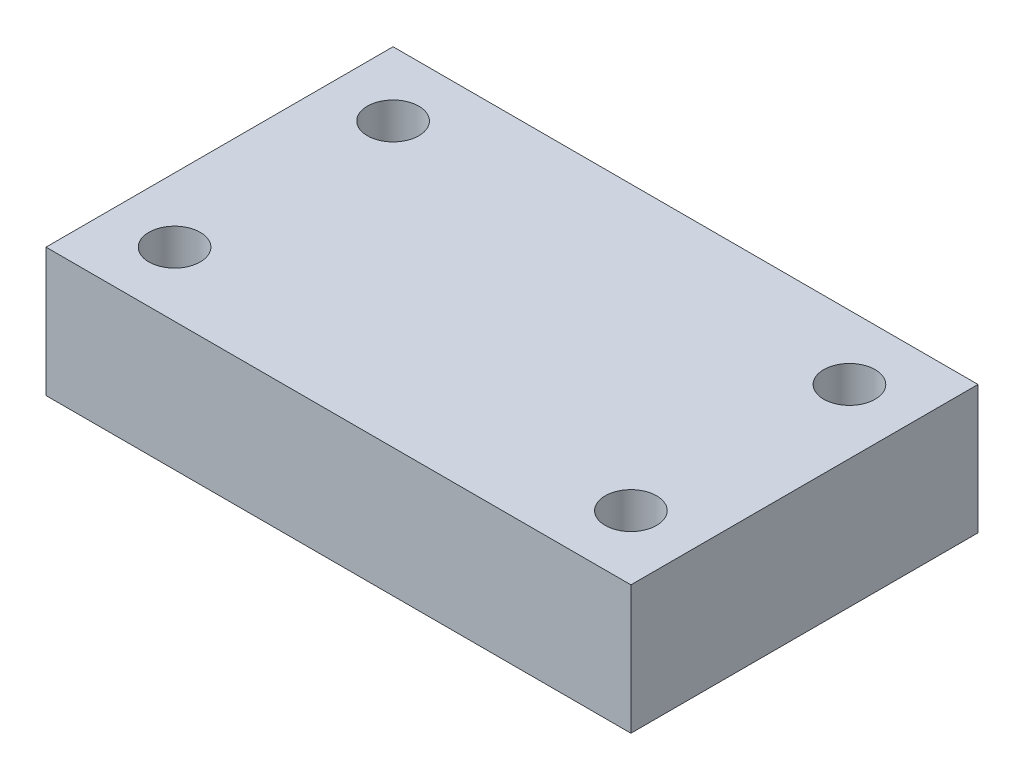
from build123d import *

# Parameters (mm, degrees)
SKETCH1_W           = 45.5
SKETCH1_H           = 27
SKETCH1_R           = 2
BOSS_EXTRUDE1_DEPTH = 10
SKETCH2_R           = 3
CUT_EXTRUDE1_DEPTH  = 6


with BuildPart() as part:
    # Sketch1 → Boss-Extrude1 (new body)
    with BuildSketch(Plane(origin=(0, 0, 0), x_dir=(1, 0, 0), z_dir=(0, 1, 0))):
        Rectangle(SKETCH1_W, SKETCH1_H)
        with Locations(Location((-17.75, 8.5, 0), (0, 0, 270))):
            Circle(SKETCH1_R, mode=Mode.SUBTRACT)
        with Locations(Location((-17.75, -8.5, 0), (0, 0, 270))):
            Circle(SKETCH1_R, mode=Mode.SUBTRACT)
        with Locations(Location((17.75, 8.5, 0), (0, 0, 270))):
            Circle(SKETCH1_R, mode=Mode.SUBTRACT)
        with Locations(Location((17.75, -8.5, 0), (0, 0, 270))):
            Circle(SKETCH1_R, mode=Mode.SUBTRACT)
    extrude(amount=BOSS_EXTRUDE1_DEPTH)

    # Sketch2 → Cut-Extrude1 (cut)
    with BuildSketch(Plane.XZ):
        with Locations(Location((-17.75, 8.5, 0), (0, 0, 270))):
            Circle(SKETCH2_R)
        with Locations(Location((-17.75, -8.5, 0), (0, 0, 270))):
            Circle(SKETCH2_R)
        with Locations(Location((17.75, -8.5, 0), (0, 0, 90))):
            Circle(SKETCH2_R)
        with Locations(Location((17.75, 8.5, 0), (0, 0, 90))):
            Circle(SKETCH2_R)
    extrude(amount=-CUT_EXTRUDE1_DEPTH, mode=Mode.SUBTRACT)


solid = part.part
